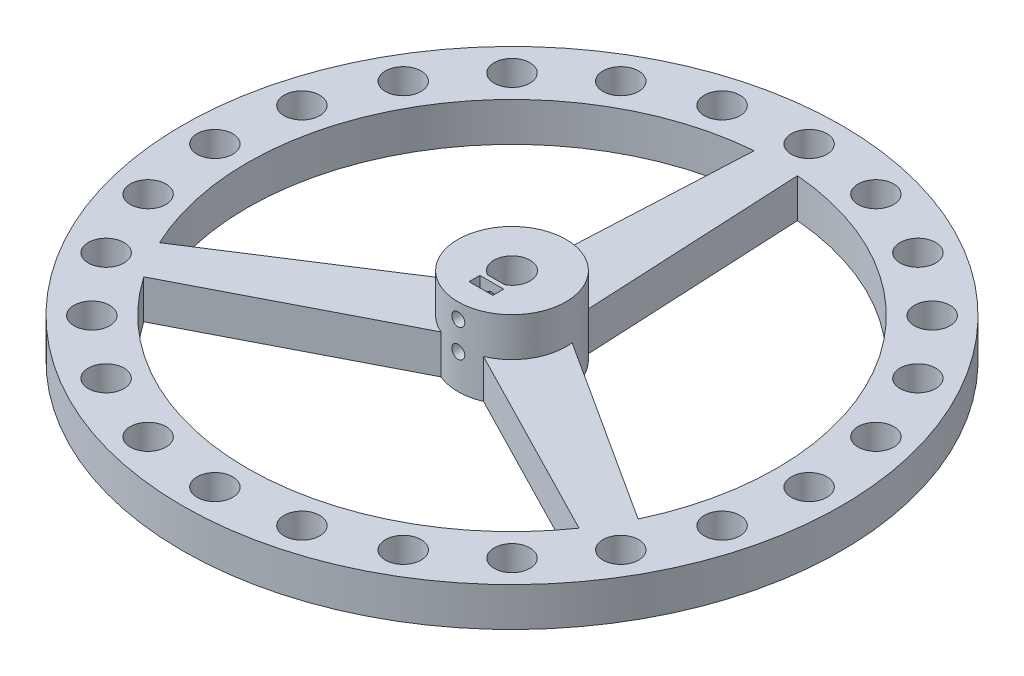
from build123d import *
from build123d.topology import SkipClean

# Parameters (mm, degrees)
SKETCH1_R                      = 76.2
BOSS_EXTRUDE1_DEPTH            = 9
SKETCH2_R                      = 12.5
BOSS_EXTRUDE2_DEPTH            = 9
CUT_EXTRUDE1_DEPTH             = 13
CUT_EXTRUDE2_START             = -1
CUT_EXTRUDE2_DEPTH             = 2.5
CUT_EXTRUDE3_REACH             = 116.376
SKETCH5_R                      = 1.5
CUT_EXTRUDE3_DIRECTION_2_REACH = 116.376
SKETCH6_W                      = 5.5
SKETCH6_H                      = 2.5
CUT_EXTRUDE4_DEPTH             = 109.188743625
SKETCH7_R                      = 4.125
CUT_EXTRUDE5_DEPTH             = 109.138244862
CIRPATTERN1_COUNT              = 24


with BuildPart() as part:
    # Sketch1 → Boss-Extrude1 (new body)
    with BuildSketch(Plane(origin=(0, 0, 0), x_dir=(1, 0, 0), z_dir=(0, 1, 0))):
        with Locations(Location((0, 0, 0), (0, 0, 270))):
            Circle(SKETCH1_R)
        with BuildLine():
            Line((-7.5, 10), (-5, 60.995409663))
            ThreePointArc((-5, 60.995409663), (-53.000754712, 30.6), (-55.323574283, -26.167577813))
            Line((-55.323574283, -26.167577813), (-12.410254038, 1.495190528))
            ThreePointArc((-12.410254038, 1.495190528), (-10.825317547, 6.25), (-7.5, 10))
        make_face(mode=Mode.SUBTRACT)
        with BuildLine():
            Line((5, 60.995409663), (7.5, 10))
            ThreePointArc((7.5, 10), (10.825317547, 6.25), (12.410254038, 1.495190528))
            Line((12.410254038, 1.495190528), (55.323574283, -26.167577813))
            ThreePointArc((55.323574283, -26.167577813), (53.000754712, 30.6), (5, 60.995409663))
        make_face(mode=Mode.SUBTRACT)
        with BuildLine():
            Line((50.323574283, -34.827831851), (4.910254038, -11.495190528))
            ThreePointArc((4.910254038, -11.495190528), (0, -12.5), (-4.910254038, -11.495190528))
            Line((-4.910254038, -11.495190528), (-50.323574283, -34.827831851))
            ThreePointArc((-50.323574283, -34.827831851), (0, -61.2), (50.323574283, -34.827831851))
        make_face(mode=Mode.SUBTRACT)
    extrude(amount=BOSS_EXTRUDE1_DEPTH)

    # Sketch2 → Boss-Extrude2 (add)
    with BuildSketch(Plane(origin=(0, 9, 0), x_dir=(1, 0, 0), z_dir=(0, 1, 0))):
        with Locations(Location((0, 0, 0), (0, 0, 126.869897646))):
            Circle(SKETCH2_R)
    extrude(amount=BOSS_EXTRUDE2_DEPTH)

    # Sketch3 → Cut-Extrude1 (cut)
    with BuildSketch(Plane.XZ.offset(-18)):
        with BuildLine():
            Line((-1.981161276, 3.675), (1.981161276, 3.675))
            ThreePointArc((1.981161276, 3.675), (0, -4.175), (-1.981161276, 3.675))
        make_face()
    extrude(amount=CUT_EXTRUDE1_DEPTH, mode=Mode.SUBTRACT)

    # Sketch4 → Cut-Extrude2 (cut)
    with BuildSketch(Plane(origin=(0, 0, 3.675), x_dir=(-1, 0, 0), z_dir=(0, 0, -1)).offset(CUT_EXTRUDE2_START)):
        Polygon((0, 11.175426481), (-2.75, 9.58771324), (-2.75, 6.41228676), (0, 4.824573519), (2.75, 6.41228676), (2.75, 9.58771324), align=None)
    extrude(amount=-CUT_EXTRUDE2_DEPTH, mode=Mode.SUBTRACT)

    # Sketch5 → Cut-Extrude3 (cut, up to next)
    with BuildSketch(Plane(origin=(0, 0, 7.175), x_dir=(-1, 0, 0), z_dir=(0, 0, -1)), mode=Mode.PRIVATE) as cut_extrude3_sk1:
        with Locations((0, 8)):
            Circle(SKETCH5_R)
    cut_extrude3_tool1 = extrude(cut_extrude3_sk1.sketch, amount=-CUT_EXTRUDE3_REACH, mode=Mode.PRIVATE) & part.part
    # Sketch5 → Cut-Extrude3 (cut, up to next)
    with BuildSketch(Plane(origin=(0, 0, 7.175), x_dir=(-1, 0, 0), z_dir=(0, 0, -1)), mode=Mode.PRIVATE) as cut_extrude3_sk2:
        with Locations((0, 14.5)):
            Circle(SKETCH5_R)
    cut_extrude3_tool2 = extrude(cut_extrude3_sk2.sketch, amount=-CUT_EXTRUDE3_REACH, mode=Mode.PRIVATE) & part.part
    add(cut_extrude3_tool1.solids().sort_by_distance((0, 8, 7.175))[0], mode=Mode.SUBTRACT)
    add(cut_extrude3_tool2.solids().sort_by_distance((0, 14.5, 7.175))[0], mode=Mode.SUBTRACT)

    # Sketch5 → Cut-Extrude3 direction 2 (cut, up to next)
    with BuildSketch(Plane(origin=(0, 0, 7.175), x_dir=(-1, 0, 0), z_dir=(0, 0, -1)), mode=Mode.PRIVATE) as cut_extrude3_direction_2_sk1:
        with Locations((0, 8)):
            Circle(SKETCH5_R)
    cut_extrude3_direction_2_tool1 = extrude(cut_extrude3_direction_2_sk1.sketch, amount=CUT_EXTRUDE3_DIRECTION_2_REACH, mode=Mode.PRIVATE) & part.part
    # Sketch5 → Cut-Extrude3 direction 2 (cut, up to next)
    with BuildSketch(Plane(origin=(0, 0, 7.175), x_dir=(-1, 0, 0), z_dir=(0, 0, -1)), mode=Mode.PRIVATE) as cut_extrude3_direction_2_sk2:
        with Locations((0, 14.5)):
            Circle(SKETCH5_R)
    cut_extrude3_direction_2_tool2 = extrude(cut_extrude3_direction_2_sk2.sketch, amount=CUT_EXTRUDE3_DIRECTION_2_REACH, mode=Mode.PRIVATE) & part.part
    add(cut_extrude3_direction_2_tool1.solids().sort_by_distance((0, 8, 7.175))[0], mode=Mode.SUBTRACT)
    add(cut_extrude3_direction_2_tool2.solids().sort_by_distance((0, 14.5, 7.175))[0], mode=Mode.SUBTRACT)

    # Sketch6 → Cut-Extrude4 (cut, through all)
    with BuildSketch(Plane(origin=(0, 9.58771324, 0), x_dir=(1, 0, 0), z_dir=(0, 1, 0))):
        with Locations((0, -5.925)):
            Rectangle(SKETCH6_W, SKETCH6_H)
    extrude(amount=CUT_EXTRUDE4_DEPTH, mode=Mode.SUBTRACT)

    # Sketch7 → Cut-Extrude5 (cut, through all)
    with SkipClean():  # the faces are left unmerged after this step: merging them gives an invalid solid
        with BuildSketch(Plane(origin=(0, 9, 0), x_dir=(1, 0, 0), z_dir=(0, 1, 0))):
            with Locations(Location((0, 68.7, 0), (0, 0, 270))):
                Circle(SKETCH7_R)
        cut_extrude5 = extrude(amount=-CUT_EXTRUDE5_DEPTH, mode=Mode.SUBTRACT)

    # CirPattern1: Cut-Extrude5 ×24 about axis
    with SkipClean():  # the faces are left unmerged after this step: merging them gives an invalid solid
        cirpattern1_axis = Axis((0, 0, 0), (0, 1, 0))
        for i in range(1, CIRPATTERN1_COUNT):
            add(cut_extrude5.rotate(cirpattern1_axis, i * 360 / CIRPATTERN1_COUNT), mode=Mode.SUBTRACT)


solid = part.part
